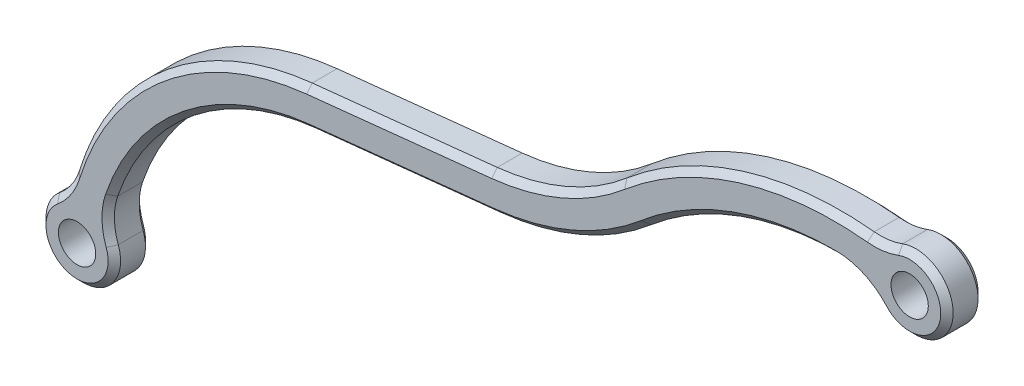
from build123d import *

# Parameters (mm, degrees)
SKETCH1_R             = 3
SKETCH1_R_2           = 1.5
BOSS_EXTRUDE1_DEPTH   = 3
BOSS_EXTRUDE1_2_DEPTH = 3
EXTRUDE_THIN1_DEPTH   = 3
FILLET1_R             = 5
CHAMFER1_SIZE         = 0.5


with BuildPart() as part:
    # Sketch1 → Boss-Extrude1 (new body)
    with BuildSketch(Plane.XY):
        with Locations((-83.950540957, -19.912145865)):
            Circle(SKETCH1_R)
        with Locations((-83.950540957, -19.912145865)):
            Circle(SKETCH1_R_2, mode=Mode.SUBTRACT)
    extrude(amount=BOSS_EXTRUDE1_DEPTH)



with BuildPart() as body_2:
    # Sketch1 → Boss-Extrude1 2 (new body)
    with BuildSketch(Plane.XY):
        with Locations((-17, 9.92820323)):
            Circle(SKETCH1_R)
        with Locations((-17, 9.92820323)):
            Circle(SKETCH1_R_2, mode=Mode.SUBTRACT)
    extrude(amount=BOSS_EXTRUDE1_2_DEPTH)


with BuildPart() as part_1:
    add(part.part)

    add(body_2.part)  # Extrude-Thin1 merges body 2
    # Sketch2 → Extrude-Thin1 (add)
    with BuildSketch(Plane.XY):
        with BuildLine():
            ThreePointArc((-81.866086482, -18.096227729), (-76.0782564, -7.689979577), (-65.226210809, -2.788746653))
            Line((-65.226210809, -2.788746653), (-50.342422521, -1.224397467))
            ThreePointArc((-50.342422521, -1.224397467), (-43.92427654, 0.448702034), (-38.289233854, 3.947009295))
            ThreePointArc((-38.289233854, 3.947009295), (-29.303097517, 8.716235486), (-19.143567587, 9.245495681))
            Line((-19.143567587, 9.245495681), (-18.648168411, 12.204309575))
            ThreePointArc((-18.648168411, 12.204309575), (-30.10325921, 11.607557202), (-40.235323233, 6.230151019))
            ThreePointArc((-40.235323233, 6.230151019), (-45.107146333, 3.205660332), (-50.65600791, 1.759168219))
            Line((-50.65600791, 1.759168219), (-65.539796199, 0.194819033))
            ThreePointArc((-65.539796199, 0.194819033), (-78.10933943, -5.482106907), (-84.813179718, -17.535298624))
            Line((-84.813179718, -17.535298624), (-81.866086482, -18.096227729))
        make_face()
    extrude(amount=EXTRUDE_THIN1_DEPTH)

    # Fillet1
    fillet1_edges = [part_1.edges().sort_by_distance(p)[0] for p in [
        (-84.706300556, -17.008901571, 1.5),
        (-81.809477217, -17.810754407, 1.5),
        (-18.904716374, 12.245972748, 1.5),
        (-19.94680617, 9.365767994, 1.5),
    ]]
    fillet(fillet1_edges, radius=FILLET1_R)

    # Chamfer1
    chamfer1_edges = [part_1.edges().sort_by_distance(p)[0] for p in [
        (-77.195374918, -4.686748809, 0),
        (-75.062303692, -6.819526639, 3),
        (-57.784316665, -2.00657206, 3),
        (-43.92427654, 0.448702034, 3),
        (-45.107146333, 3.205660332, 0),
        (-58.097902055, 0.976993626, 0),
        (-45.107146333, 3.205660332, 3),
        (-58.097902055, 0.976993626, 3),
        (-77.195374918, -4.686748809, 3),
        (-75.062303692, -6.819526639, 0),
        (-43.92427654, 0.448702034, 0),
        (-57.784316665, -2.00657206, 0),
        (-84.737508384, -22.807086671, 0),
        (-84.737508384, -22.807086671, 3),
        (-31.106705209, 8.137983689, 0),
        (-31.106705209, 8.137983689, 3),
        (-14.083717416, 9.224430618, 0),
        (-14.083717416, 9.224430618, 3),
        (-30.92519874, 11.365731626, 0),
        (-30.92519874, 11.365731626, 3),
        (-84.860623121, -16.505866782, 3),
        (-84.860623121, -16.505866782, 0),
        (-81.450241332, -17.19340927, 3),
        (-81.450241332, -17.19340927, 0),
        (-20.896879636, 9.132244106, 3),
        (-20.896879636, 9.132244106, 0),
        (-19.18823543, 12.449634759, 3),
        (-19.18823543, 12.449634759, 0),
    ]]
    chamfer(chamfer1_edges, length=CHAMFER1_SIZE)


solid = part_1.part
